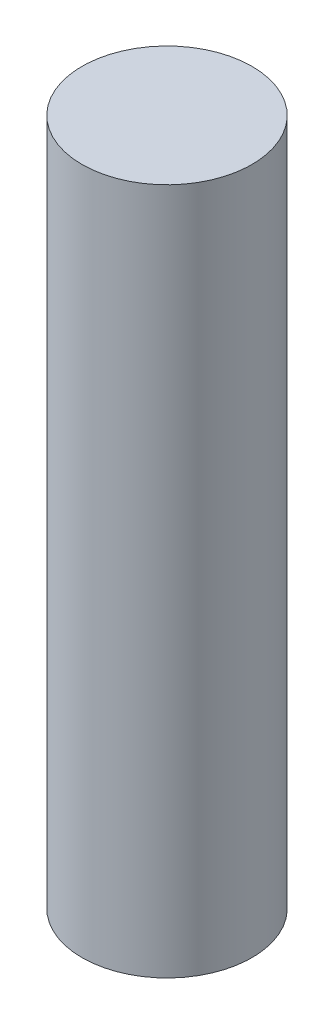
from build123d import *

# Parameters (mm, degrees)
SKETCH1_R           = 2.5
BOSS_EXTRUDE1_DEPTH = 20.2


with BuildPart() as part:
    # Sketch1 → Boss-Extrude1 (new body)
    with BuildSketch(Plane(origin=(0, 0, 0), x_dir=(1, 0, 0), z_dir=(0, 1, 0))):
        with Locations(Location((0, 0, 0), (0, 0, 270))):
            Circle(SKETCH1_R)
    extrude(amount=BOSS_EXTRUDE1_DEPTH)


solid = part.part
